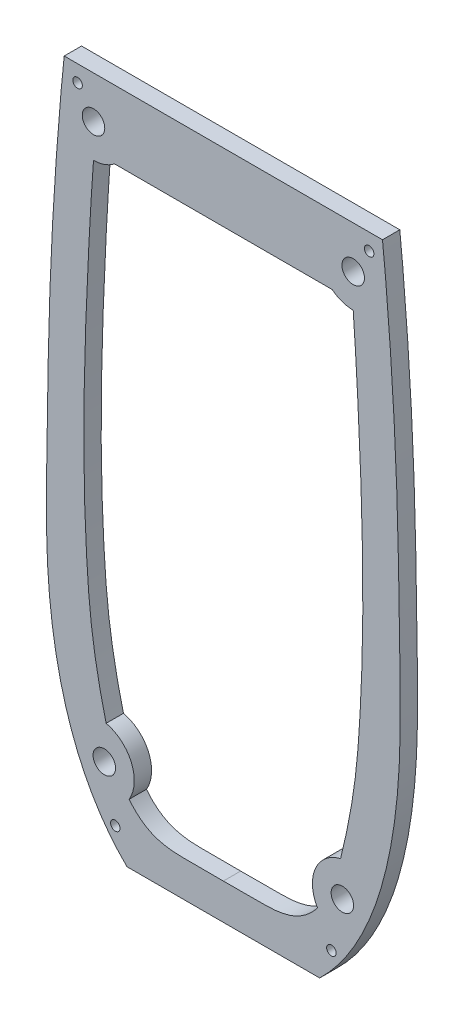
from build123d import *

# Parameters (mm, degrees)
SKETCH1_R           = 2.6
SKETCH1_RX          = 1.1
SKETCH1_RY          = 1.09932991
BOSS_EXTRUDE1_DEPTH = 4


with BuildPart() as part:
    # Sketch1 → Boss-Extrude1 (new body)
    with BuildSketch(Plane.XY):
        with BuildLine():
            Line((0, 5.692059911), (0, 13.960803037))
            add(Edge.make_bspline(
                [(0, 13.960803037), (-10.899339386, 13.960803037), (-11.487218892, 13.959349751), (-16.235559114, 14.8374748), (-19.42281347, 16.455642741), (-21.75810774, 19.451339794)],
                knots=[0, 0, 0, 0, 0.128416155, 0.156586267, 0.281701124, 0.281701124, 0.281701124, 0.281701124], degree=3))
            add(Edge.make_bspline(
                [(-21.75810774, 19.451339794), (-15.903861103, 29.32920361), (-27.080177886, 31.983395584)],
                knots=[5.748445187, 5.748445187, 5.748445187, 7.620680331, 7.620680331, 7.620680331], degree=2, weights=[1, 0.592918858, 1]))
            add(Edge.make_bspline(
                [(-27.080177886, 31.983395584), (-28.706578592, 38.396584339), (-30.515490185, 47.815165764), (-32.416424554, 73.43436988), (-32.552747016, 100.120175104), (-30.539348615, 136.048346927), (-30.002573633, 143.19486067)],
                knots=[0.399896913, 0.399896913, 0.399896913, 0.399896913, 0.535865385, 0.582419791, 0.865440975, 0.98918278, 0.98918278, 0.98918278, 0.98918278], degree=3))
            add(Edge.make_bspline(
                [(-30.002573633, 143.19486067), (-27.281829786, 143.193954313), (-25.161578064, 144.897902642)],
                knots=[1.570462995, 1.570462995, 1.570462995, 2.248058784, 2.248058784, 2.248058784], degree=2, weights=[1, 0.943154871, 1]))
            Line((-25.161578064, 144.897902642), (0, 144.897902642))
            Line((0, 144.897902642), (0, 160.670428059))
            Line((0, 160.670428059), (-36.767608898, 160.670428059))
            add(Edge.make_bspline(
                [(-36.767608898, 160.670428059), (-37.046640535, 158.607809885), (-40.071993295, 127.385925043), (-40.803180234, 77.536053485), (-41.343202954, 45.35813169), (-33.894171557, 17.037301791), (-22.259388115, 5.692059911)],
                knots=[0, 0, 0, 0, 0.322711204, 0.500184687, 0.698743588, 1, 1, 1, 1], degree=3))
            Line((-22.259388115, 5.692059911), (0, 5.692059911))
        make_face()
        with Locations((-27.5, 24.087668969)):
            Circle(SKETCH1_R, mode=Mode.SUBTRACT)
        with Locations((-30, 150.911100024)):
            Circle(SKETCH1_R, mode=Mode.SUBTRACT)
        with Locations(Location((-33.687866417, 156.849138163), (0, 0, 180))):
            Ellipse(SKETCH1_RX, SKETCH1_RY, mode=Mode.SUBTRACT)
        with Locations(Location((-24.963406725, 12.566629974), (0, 0, 180))):
            Ellipse(SKETCH1_RX, SKETCH1_RY, mode=Mode.SUBTRACT)
    boss_extrude1 = extrude(amount=BOSS_EXTRUDE1_DEPTH)

    # Mirror1: Boss-Extrude1 across plane
    add(boss_extrude1.mirror(Plane(origin=(0, 160.670428059, 4), x_dir=(0, 0, 1), z_dir=(-1, 0, 0))))


solid = part.part
